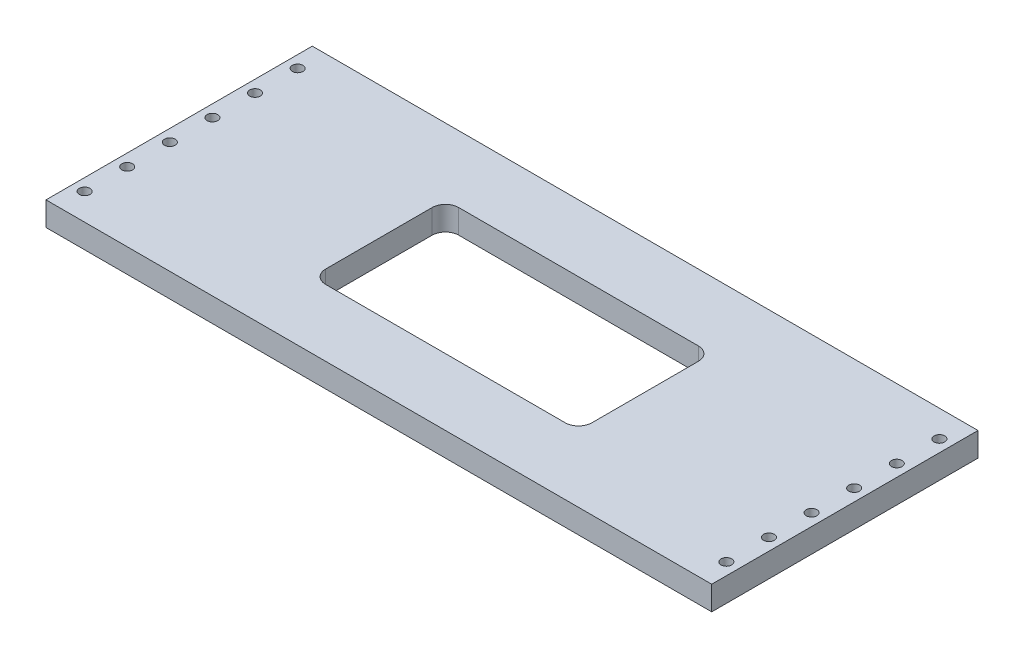
from build123d import *

# Parameters (mm, degrees)
SKETCH1_W           = 500
SKETCH1_H           = 200
BOSS_EXTRUDE1_DEPTH = 18
SKETCH2_R           = 4
CUT_EXTRUDE1_DEPTH  = 10
CUT_EXTRUDE2_DEPTH  = 30


with BuildPart() as part:
    # Sketch1 → Boss-Extrude1 (new body)
    with BuildSketch(Plane(origin=(0, 0, 0), x_dir=(1, 0, 0), z_dir=(0, 1, 0))):
        with Locations((250, 100)):
            Rectangle(SKETCH1_W, SKETCH1_H)
    extrude(amount=BOSS_EXTRUDE1_DEPTH)

    # Sketch2 → Cut-Extrude1 (cut)
    with BuildSketch(Plane(origin=(0, 18, 0), x_dir=(1, 0, 0), z_dir=(0, 1, 0))):
        with Locations(Location((9, 180, 0), (0, 0, 270))):
            Circle(SKETCH2_R)
        with Locations(Location((9, 148, 0), (0, 0, 270))):
            Circle(SKETCH2_R)
        with Locations(Location((9, 116, 0), (0, 0, 270))):
            Circle(SKETCH2_R)
        with Locations(Location((9, 84, 0), (0, 0, 270))):
            Circle(SKETCH2_R)
        with Locations(Location((9, 52, 0), (0, 0, 270))):
            Circle(SKETCH2_R)
        with Locations(Location((9, 20, 0), (0, 0, 270))):
            Circle(SKETCH2_R)
        with Locations(Location((491, 20, 0), (0, 0, 90))):
            Circle(SKETCH2_R)
        with Locations(Location((491, 52, 0), (0, 0, 90))):
            Circle(SKETCH2_R)
        with Locations(Location((491, 84, 0), (0, 0, 90))):
            Circle(SKETCH2_R)
        with Locations(Location((491, 116, 0), (0, 0, 90))):
            Circle(SKETCH2_R)
        with Locations(Location((491, 148, 0), (0, 0, 90))):
            Circle(SKETCH2_R)
        with Locations(Location((491, 180, 0), (0, 0, 90))):
            Circle(SKETCH2_R)
    extrude(amount=-CUT_EXTRUDE1_DEPTH, mode=Mode.SUBTRACT)

    # Sketch3 → Cut-Extrude2 (cut)
    with BuildSketch(Plane(origin=(0, 18, 0), x_dir=(1, 0, 0), z_dir=(0, 1, 0))):
        with BuildLine():
            Line((160, 150), (340, 150))
            ThreePointArc((340, 150), (347.071067812, 147.071067812), (350, 140))
            Line((350, 140), (350, 60))
            ThreePointArc((350, 60), (347.071067812, 52.928932188), (340, 50))
            Line((340, 50), (160, 50))
            ThreePointArc((160, 50), (152.928932188, 52.928932188), (150, 60))
            Line((150, 60), (150, 140))
            ThreePointArc((150, 140), (152.928932188, 147.071067812), (160, 150))
        make_face()
    extrude(amount=-CUT_EXTRUDE2_DEPTH, mode=Mode.SUBTRACT)


solid = part.part
